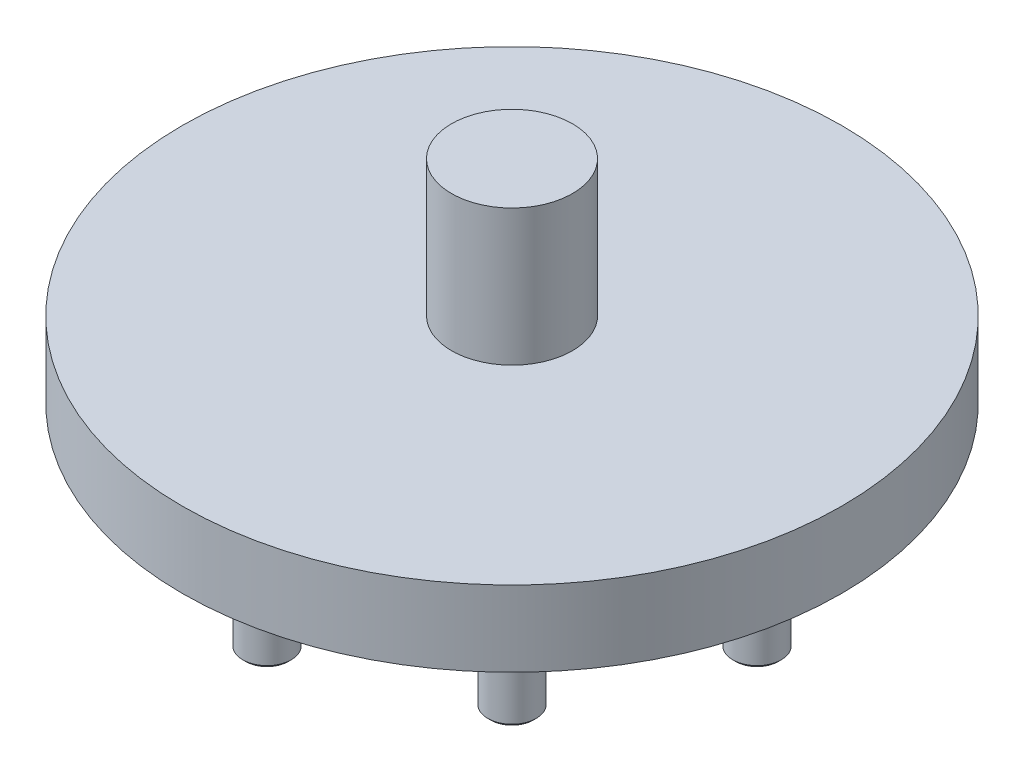
from build123d import *

# Parameters (mm, degrees)
SKETCH2_R                    = 12
BOSS_EXTRUDE1_DEPTH          = 45
CHAMFER1_SIZE                = 1.5
CIRPATTERN1_COUNT            = 8
CHAMFER1_OF_CIRPATTERN1_SIZE = 1.5


with BuildPart() as part:
    # Sketch1 → Revolve1 (revolve)
    with BuildSketch(Plane.XY, mode=Mode.PRIVATE) as revolve1_sk:
        Polygon((0, 0), (0, 112.5), (30, 112.5), (30, 45), (163.5, 45), (163.5, 7.5), (79.5, 7.5), (79.5, 0), align=None)
    revolve(revolve1_sk.sketch.rotate(Axis((0, 0, 0), (0, 1, 0)), 90), axis=Axis((0, 0, 0), (0, 1, 0)))

    # Sketch2 → Boss-Extrude1 (add)
    with BuildSketch(Plane.XZ.offset(-7.5)):
        with Locations(Location((121.5, 0, 0), (0, 0, 90))):
            Circle(SKETCH2_R)
    boss_extrude1 = extrude(amount=BOSS_EXTRUDE1_DEPTH)

    # Chamfer1
    chamfer1_edges = [part.edges().sort_by_distance(p)[0] for p in [
        (121.5, -37.5, -12),
    ]]
    chamfer(chamfer1_edges, length=CHAMFER1_SIZE)

    # CirPattern1: Boss-Extrude1 ×8 about axis
    cirpattern1_axis = Axis((0, 0, 0), (0, 1, 0))
    for i in range(1, CIRPATTERN1_COUNT):
        add(boss_extrude1.rotate(cirpattern1_axis, i * 360 / CIRPATTERN1_COUNT))

    # Chamfer1 of CirPattern1
    chamfer1_of_cirpattern1_edges = [part.edges().sort_by_distance(p)[0] for p in [
        (77.42819254, -37.5, -94.398755288),
        (-12, -37.5, -121.5),
        (-94.398755288, -37.5, -77.42819254),
        (-121.5, -37.5, 12),
        (-77.42819254, -37.5, 94.398755288),
        (12, -37.5, 121.5),
        (94.398755288, -37.5, 77.42819254),
    ]]
    chamfer(chamfer1_of_cirpattern1_edges, length=CHAMFER1_OF_CIRPATTERN1_SIZE)


solid = part.part
